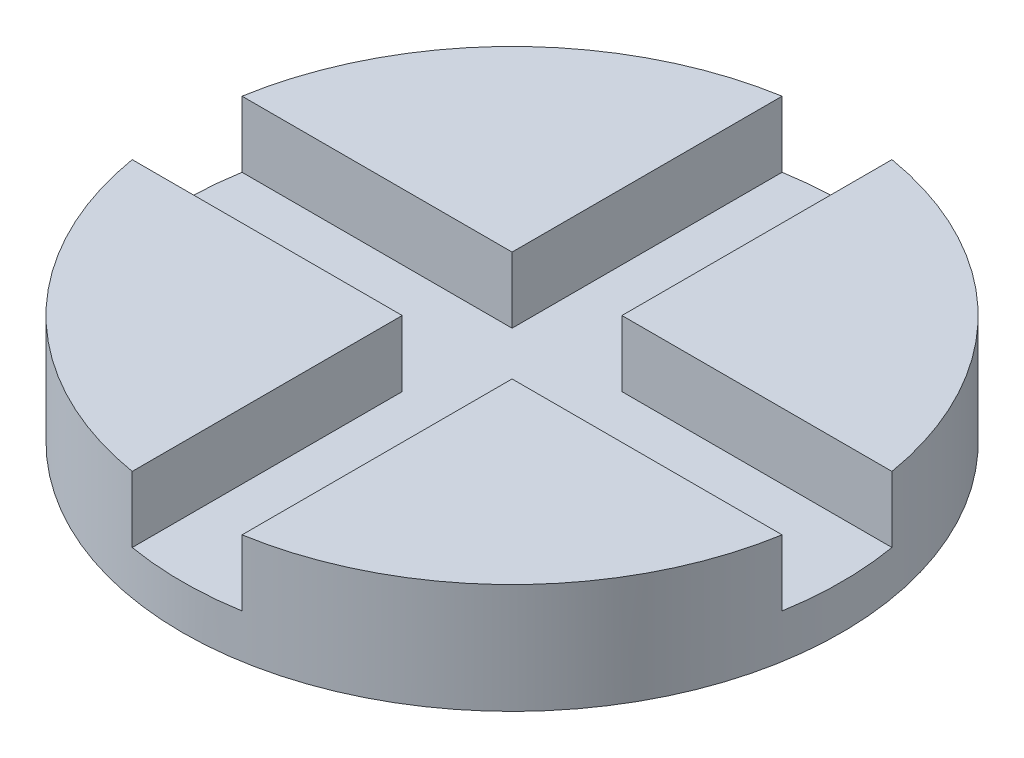
from build123d import *

# Parameters (mm, degrees)
BOSS_EXTRUDE1_DEPTH = 20
CUT_EXTRUDE1_START  = 8
CUT_EXTRUDE1_DEPTH  = 12


with BuildPart() as part:
    # Sketch1 → Boss-Extrude1 (new body)
    with BuildSketch(Plane(origin=(0, 0, 0), x_dir=(1, 0, 0), z_dir=(0, 1, 0))):
        with BuildLine():
            Line((-59.160797831, 10), (-10, 10))
            Line((-10, 10), (-10, 59.160797831))
            ThreePointArc((-10, 59.160797831), (-42.426406871, 42.426406871), (-59.160797831, 10))
        make_face()
        with BuildLine():
            Line((-10, 59.160797831), (-10, 10))
            Line((-10, 10), (-59.160797831, 10))
            ThreePointArc((-59.160797831, 10), (-60, 0), (-59.160797831, -10))
            Line((-59.160797831, -10), (-10, -10))
            Line((-10, -10), (-10, -59.160797831))
            ThreePointArc((-10, -59.160797831), (0, -60), (10, -59.160797831))
            Line((10, -59.160797831), (10, -10))
            Line((10, -10), (59.160797831, -10))
            ThreePointArc((59.160797831, -10), (59.789831367, -5.017575617), (60, 0))
            ThreePointArc((60, 0), (59.789831367, 5.017575617), (59.160797831, 10))
            Line((59.160797831, 10), (10, 10))
            Line((10, 10), (10, 59.160797831))
            ThreePointArc((10, 59.160797831), (0, 60), (-10, 59.160797831))
        make_face()
        with BuildLine():
            Line((-10, -10), (-59.160797831, -10))
            ThreePointArc((-59.160797831, -10), (-42.426406871, -42.426406871), (-10, -59.160797831))
            Line((-10, -59.160797831), (-10, -10))
        make_face()
        with BuildLine():
            ThreePointArc((59.160797831, 10), (42.426406871, 42.426406871), (10, 59.160797831))
            Line((10, 59.160797831), (10, 10))
            Line((10, 10), (59.160797831, 10))
        make_face()
        with BuildLine():
            Line((10, -10), (10, -59.160797831))
            ThreePointArc((10, -59.160797831), (42.426406871, -42.426406871), (59.160797831, -10))
            Line((59.160797831, -10), (10, -10))
        make_face()
    extrude(amount=BOSS_EXTRUDE1_DEPTH)

    # Sketch1<3> → Cut-Extrude1 (cut)
    with BuildSketch(Plane(origin=(0, 0, 0), x_dir=(1, 0, 0), z_dir=(0, 1, 0)).offset(CUT_EXTRUDE1_START)):
        with BuildLine():
            Line((-10, 59.160797831), (-10, 10))
            Line((-10, 10), (-59.160797831, 10))
            ThreePointArc((-59.160797831, 10), (-60, 0), (-59.160797831, -10))
            Line((-59.160797831, -10), (-10, -10))
            Line((-10, -10), (-10, -59.160797831))
            ThreePointArc((-10, -59.160797831), (0, -60), (10, -59.160797831))
            Line((10, -59.160797831), (10, -10))
            Line((10, -10), (59.160797831, -10))
            ThreePointArc((59.160797831, -10), (59.789831367, -5.017575617), (60, 0))
            ThreePointArc((60, 0), (59.789831367, 5.017575617), (59.160797831, 10))
            Line((59.160797831, 10), (10, 10))
            Line((10, 10), (10, 59.160797831))
            ThreePointArc((10, 59.160797831), (0, 60), (-10, 59.160797831))
        make_face()
    extrude(amount=CUT_EXTRUDE1_DEPTH, mode=Mode.SUBTRACT)


solid = part.part
